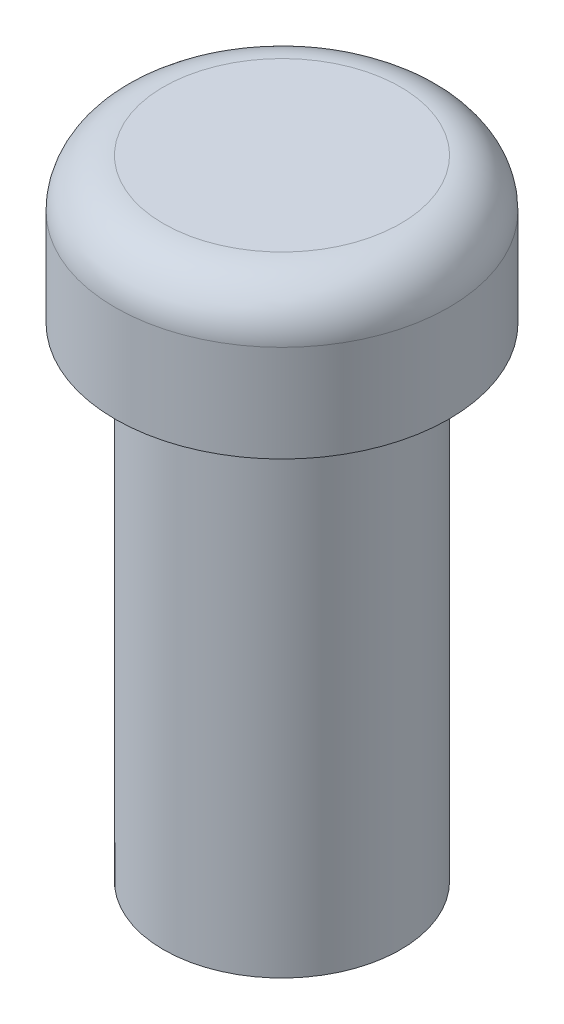
from build123d import *

# Parameters (mm, degrees)
SKETCH1_R           = 2.45
BOSS_EXTRUDE1_DEPTH = 10
SKETCH2_R           = 3.45
BOSS_EXTRUDE2_DEPTH = 3
FILLET1_R           = 1


with BuildPart() as part:
    # Sketch1 → Boss-Extrude1 (new body)
    with BuildSketch(Plane(origin=(0, 0, 0), x_dir=(1, 0, 0), z_dir=(0, 1, 0))):
        with Locations(Location((0, 0, 0), (0, 0, 270))):
            Circle(SKETCH1_R)
    extrude(amount=BOSS_EXTRUDE1_DEPTH)

    # Sketch2 → Boss-Extrude2 (add)
    with BuildSketch(Plane(origin=(0, 10, 0), x_dir=(1, 0, 0), z_dir=(0, 1, 0))):
        with Locations(Location((0, 0, 0), (0, 0, 270))):
            Circle(SKETCH2_R)
    extrude(amount=BOSS_EXTRUDE2_DEPTH)

    # Fillet1
    fillet1_edges = [part.edges().sort_by_distance(p)[0] for p in [
        (0, 13, -3.45),
    ]]
    fillet(fillet1_edges, radius=FILLET1_R)


solid = part.part
